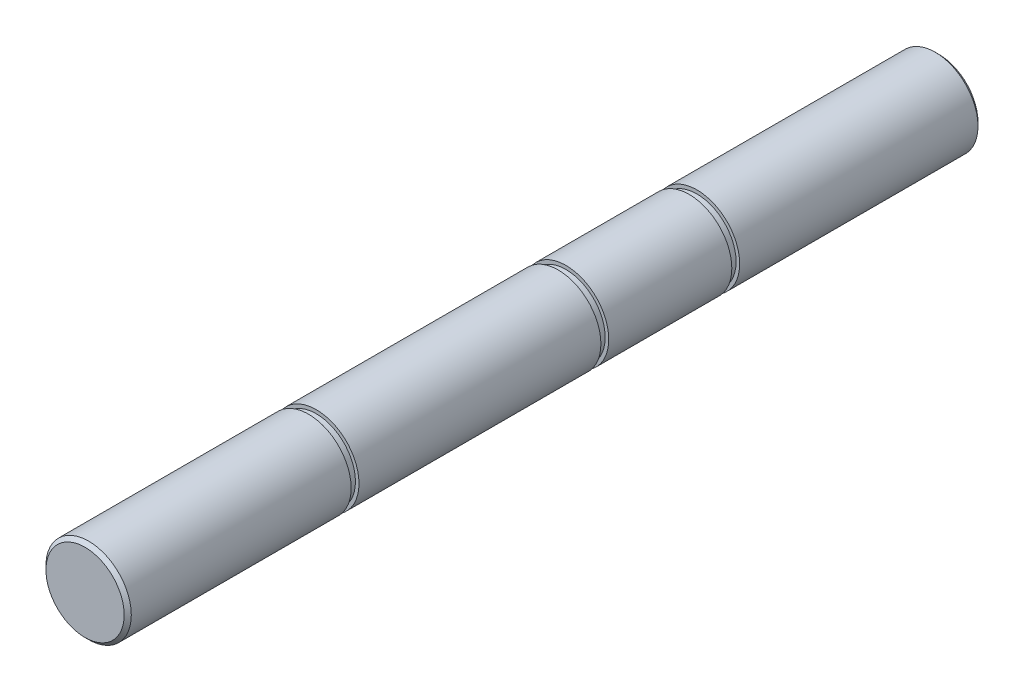
from build123d import *

# Parameters (mm, degrees)
SKETCH_1_R          = 6
EXTRUDE_1_DEPTH     = 120
CUT_EXTRUDE_START   = -3.5
CUT_EXTRUDE_1_DEPTH = 10
SKETCH_3_W          = 1.1
SKETCH_3_H          = 0.5
CHAMFER_1_SIZE      = 0.5


with BuildPart() as part:
    # 草图1 → 凸台-拉伸1 (new body)
    with BuildSketch(Plane.XY):
        Circle(SKETCH_1_R)
    extrude(amount=EXTRUDE_1_DEPTH)

    # 草图2 → 切除-拉伸1 (cut)
    with BuildSketch(Plane(origin=(0, 0, 0), x_dir=(1, 0, 0), z_dir=(0, 1, 0)).offset(CUT_EXTRUDE_START)):
        with BuildLine():
            Line((2, -58), (2, -84))
            ThreePointArc((2, -84), (0, -86), (-2, -84))
            Line((-2, -84), (-2, -58))
            ThreePointArc((-2, -58), (0, -56), (2, -58))
        make_face()
    extrude(amount=-CUT_EXTRUDE_1_DEPTH, mode=Mode.SUBTRACT)

    # 草图3 → 切除-旋转1 (revolve, cut)
    with BuildSketch(Plane(origin=(0, 0, 0), x_dir=(0, 0, -1), z_dir=(1, 0, 0)), mode=Mode.PRIVATE) as cut_revolve_1_sk:
        with Locations((-88.05, 5.75)):
            Rectangle(SKETCH_3_W, SKETCH_3_H)
        with Locations((-34.55, 5.75)):
            Rectangle(SKETCH_3_W, SKETCH_3_H)
        with Locations((-52.95, 5.75)):
            Rectangle(SKETCH_3_W, SKETCH_3_H)
    revolve(cut_revolve_1_sk.sketch.rotate(Axis((0, 0, 130.661115057), (0, 0, -1)), 90), axis=Axis((0, 0, 130.661115057), (0, 0, -1)), mode=Mode.SUBTRACT)

    # 倒角1
    chamfer_1_edges = [part.edges().sort_by_distance(p)[0] for p in [
        (-6, 0, 0),
        (-6, 0, 120),
    ]]
    chamfer(chamfer_1_edges, length=CHAMFER_1_SIZE)


solid = part.part
